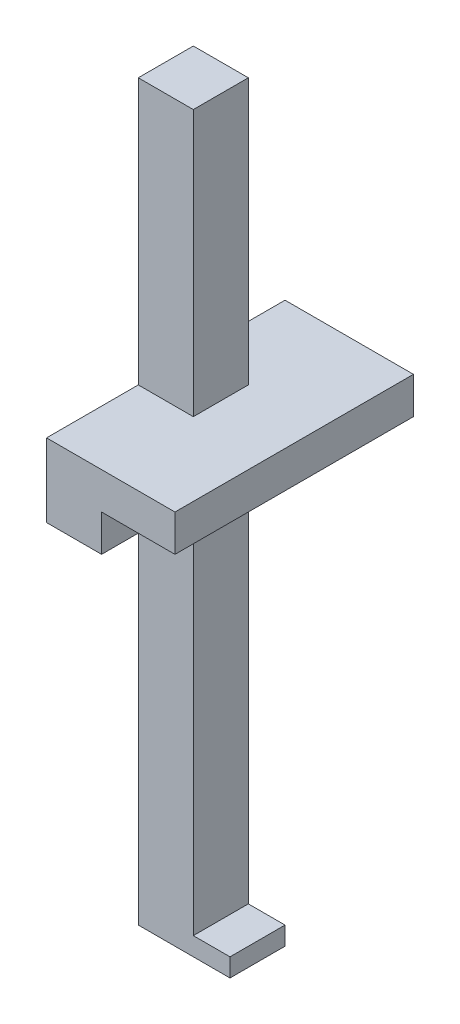
from build123d import *

# Parameters (mm, degrees)
BOSS_EXTRUDE1_DEPTH = 3
SKETCH2_W           = 3
SKETCH2_H           = 4
BOSS_EXTRUDE2_DEPTH = 5
SKETCH5_W           = 13
SKETCH5_H           = 2
BOSS_EXTRUDE4_DEPTH = 4


with BuildPart() as part:
    # Sketch1 → Boss-Extrude1 (new body)
    with BuildSketch(Plane.XY):
        Polygon((0, 0), (0, 40), (3, 40), (3, 1), (5, 1), (5, 0), align=None)
    extrude(amount=BOSS_EXTRUDE1_DEPTH)

    # Sketch2 → Boss-Extrude2 (add)
    with BuildSketch(Plane.XY.offset(3)):
        with Locations((1.5, 23.5)):
            Rectangle(SKETCH2_W, SKETCH2_H)
    boss_extrude2 = extrude(amount=BOSS_EXTRUDE2_DEPTH)

    # Mirror1: Boss-Extrude2 across plane
    add(boss_extrude2.mirror(Plane.XY.offset(1.5)))

    # Sketch5 → Boss-Extrude4 (add)
    with BuildSketch(Plane(origin=(3, 0, 0), x_dir=(0, 0, -1), z_dir=(1, 0, 0))):
        with Locations((-1.5, 24.5)):
            Rectangle(SKETCH5_W, SKETCH5_H)
    extrude(amount=BOSS_EXTRUDE4_DEPTH)


solid = part.part
